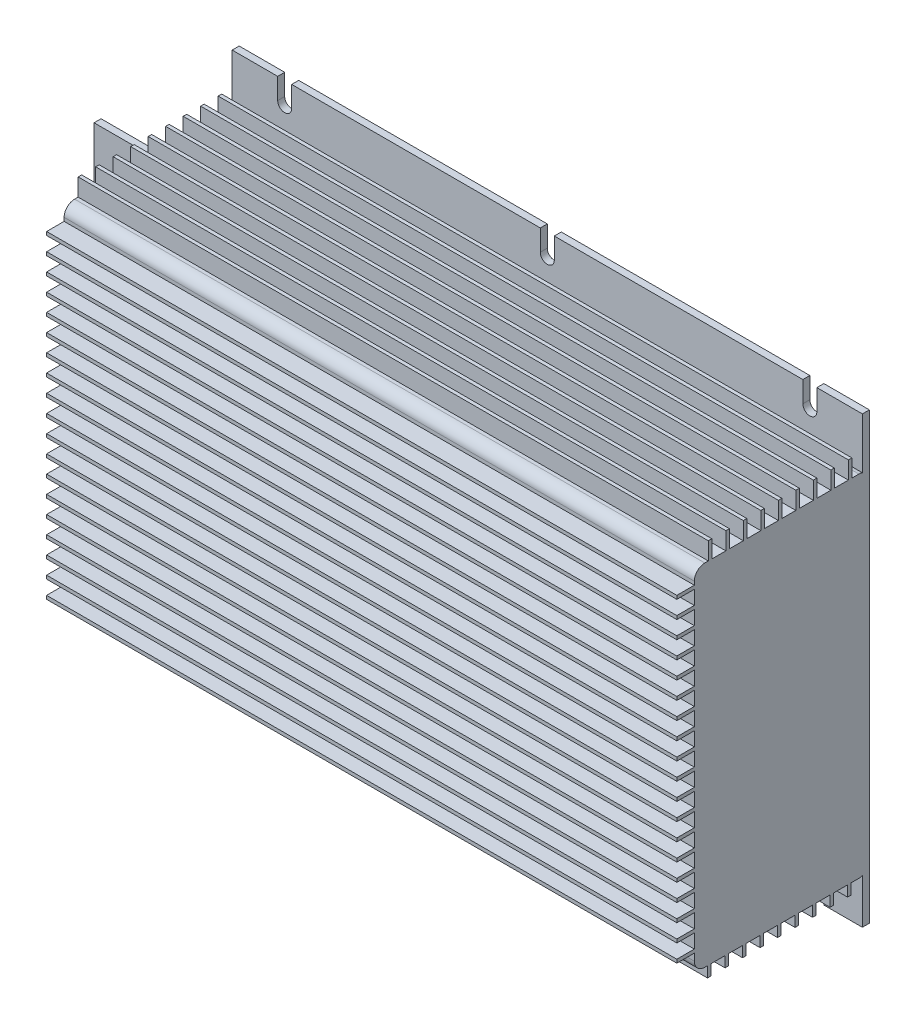
from build123d import *

# Parameters (mm, degrees)
SKETCH_1_W                       = 180
SKETCH_1_H                       = 100
EXTRUDE_1_DEPTH                  = 50
FILLET_1_R                       = 3
SKETCH_2_W                       = 180
SKETCH_2_H                       = 127
EXTRUDE_2_DEPTH                  = 2
SKETCH_3_W                       = 180
SKETCH_3_H                       = 1
EXTRUDE_3_DEPTH                  = 5
PATTERN_LINEAR_1_COUNT           = 19
PATTERN_LINEAR_1_PITCH           = 5
SKETCH_4_W                       = 180
SKETCH_4_H                       = 1
EXTRUDE_4_DEPTH                  = 5
PATTERN_LINEAR_2_COUNT           = 9
PATTERN_LINEAR_2_PITCH           = 5
PATTERN_LINEAR_2_COPY_1_SKETCH_W = 180
PATTERN_LINEAR_2_COPY_1_SKETCH_H = 1
PATTERN_LINEAR_2_COPY_1_DEPTH    = 5
PATTERN_LINEAR_2_COPY_2_SKETCH_W = 180
PATTERN_LINEAR_2_COPY_2_SKETCH_H = 1
PATTERN_LINEAR_2_COPY_2_DEPTH    = 5
PATTERN_LINEAR_2_COPY_3_SKETCH_W = 180
PATTERN_LINEAR_2_COPY_3_SKETCH_H = 1
PATTERN_LINEAR_2_COPY_3_DEPTH    = 5
PATTERN_LINEAR_2_COPY_4_SKETCH_W = 180
PATTERN_LINEAR_2_COPY_4_SKETCH_H = 1
PATTERN_LINEAR_2_COPY_4_DEPTH    = 5
PATTERN_LINEAR_2_COPY_5_SKETCH_W = 180
PATTERN_LINEAR_2_COPY_5_SKETCH_H = 1
PATTERN_LINEAR_2_COPY_5_DEPTH    = 5
PATTERN_LINEAR_2_COPY_6_SKETCH_W = 180
PATTERN_LINEAR_2_COPY_6_SKETCH_H = 1
PATTERN_LINEAR_2_COPY_6_DEPTH    = 5
PATTERN_LINEAR_2_COPY_7_SKETCH_W = 180
PATTERN_LINEAR_2_COPY_7_SKETCH_H = 1
PATTERN_LINEAR_2_COPY_7_DEPTH    = 5
PATTERN_LINEAR_2_COPY_8_SKETCH_W = 180
PATTERN_LINEAR_2_COPY_8_SKETCH_H = 1
PATTERN_LINEAR_2_COPY_8_DEPTH    = 5
CUT_EXTRUDE_1_DEPTH              = 10
PATTERN_LINEAR_3_COUNT           = 3
PATTERN_LINEAR_3_PITCH           = 75
SKETCH_7_W                       = 2
SKETCH_7_H                       = 18
EXTRUDE_5_DEPTH                  = 25


with BuildPart() as part:
    # 草图1 → 凸台-拉伸1 (new body)
    with BuildSketch(Plane.XY):
        with Locations((5.073068894, -6.221294363)):
            Rectangle(SKETCH_1_W, SKETCH_1_H)
    extrude(amount=EXTRUDE_1_DEPTH)

    # 圆角1
    fillet_1_edges = [part.edges().sort_by_distance(p)[0] for p in [
        (5.073068894, 43.778705637, 50),
        (5.073068894, 43.778705637, 0),
        (5.073068894, -56.221294363, 0),
        (5.073068894, -56.221294363, 50),
    ]]
    fillet(fillet_1_edges, radius=FILLET_1_R)

    # 草图2 → 凸台-拉伸2 (add)
    with BuildSketch(Plane(origin=(0, 0, 0), x_dir=(-1, 0, 0), z_dir=(0, 0, -1))):
        with Locations((-5.073068894, -5.340626106)):
            Rectangle(SKETCH_2_W, SKETCH_2_H)
    extrude(amount=-EXTRUDE_2_DEPTH)

    # 草图3 → 凸台-拉伸3 (add)
    with BuildSketch(Plane.XY.offset(50)):
        with Locations((5.073068894, 39.278705637)):
            Rectangle(SKETCH_3_W, SKETCH_3_H)
    extrude_3 = extrude(amount=EXTRUDE_3_DEPTH)

    # 阵列(线性)1: 凸台-拉伸3 ×19
    with Locations(*[(0, -i * PATTERN_LINEAR_1_PITCH, 0) for i in range(1, PATTERN_LINEAR_1_COUNT)]):
        add(extrude_3)

    # 草图4 → 凸台-拉伸4 (add)
    with BuildSketch(Plane(origin=(0, 43.778705637, 0), x_dir=(1, 0, 0), z_dir=(0, 1, 0))):
        with Locations((5.073068894, -45.5)):
            Rectangle(SKETCH_4_W, SKETCH_4_H)
    extrude_4 = extrude(amount=EXTRUDE_4_DEPTH)

    # 镜向1: 凸台-拉伸4 across plane
    add(extrude_4.mirror(Plane(origin=(0, -5.340600965, 0.011587331), x_dir=(0, 0.002169662941040486, 0.9999976462785911), z_dir=(0, -0.9999976462785912, 0.002169662941040486))))

    # 阵列(线性)2: 凸台-拉伸4 ×9
    with Locations(*[(0, 0, -i * PATTERN_LINEAR_2_PITCH) for i in range(1, PATTERN_LINEAR_2_COUNT)]):
        add(extrude_4)

    # 阵列(线性)2 copy 1 sketch → 阵列(线性)2 copy 1 (add)
    with BuildSketch(Plane(origin=(0, -54.459495396, -4.786855714), x_dir=(1, 0, 0), z_dir=(0, -0.9999905851254449, 0.0043393156685167435))):
        with Locations((5.073068894, 45.5)):
            Rectangle(PATTERN_LINEAR_2_COPY_1_SKETCH_W, PATTERN_LINEAR_2_COPY_1_SKETCH_H)
    extrude(amount=PATTERN_LINEAR_2_COPY_1_DEPTH)

    # 阵列(线性)2 copy 2 sketch → 阵列(线性)2 copy 2 (add)
    with BuildSketch(Plane(origin=(0, -54.459495396, -9.786855714), x_dir=(1, 0, 0), z_dir=(0, -0.9999905851254449, 0.0043393156685167435))):
        with Locations((5.073068894, 45.5)):
            Rectangle(PATTERN_LINEAR_2_COPY_2_SKETCH_W, PATTERN_LINEAR_2_COPY_2_SKETCH_H)
    extrude(amount=PATTERN_LINEAR_2_COPY_2_DEPTH)

    # 阵列(线性)2 copy 3 sketch → 阵列(线性)2 copy 3 (add)
    with BuildSketch(Plane(origin=(0, -54.459495396, -14.786855714), x_dir=(1, 0, 0), z_dir=(0, -0.9999905851254449, 0.0043393156685167435))):
        with Locations((5.073068894, 45.5)):
            Rectangle(PATTERN_LINEAR_2_COPY_3_SKETCH_W, PATTERN_LINEAR_2_COPY_3_SKETCH_H)
    extrude(amount=PATTERN_LINEAR_2_COPY_3_DEPTH)

    # 阵列(线性)2 copy 4 sketch → 阵列(线性)2 copy 4 (add)
    with BuildSketch(Plane(origin=(0, -54.459495396, -19.786855714), x_dir=(1, 0, 0), z_dir=(0, -0.9999905851254449, 0.0043393156685167435))):
        with Locations((5.073068894, 45.5)):
            Rectangle(PATTERN_LINEAR_2_COPY_4_SKETCH_W, PATTERN_LINEAR_2_COPY_4_SKETCH_H)
    extrude(amount=PATTERN_LINEAR_2_COPY_4_DEPTH)

    # 阵列(线性)2 copy 5 sketch → 阵列(线性)2 copy 5 (add)
    with BuildSketch(Plane(origin=(0, -54.459495396, -24.786855714), x_dir=(1, 0, 0), z_dir=(0, -0.9999905851254449, 0.0043393156685167435))):
        with Locations((5.073068894, 45.5)):
            Rectangle(PATTERN_LINEAR_2_COPY_5_SKETCH_W, PATTERN_LINEAR_2_COPY_5_SKETCH_H)
    extrude(amount=PATTERN_LINEAR_2_COPY_5_DEPTH)

    # 阵列(线性)2 copy 6 sketch → 阵列(线性)2 copy 6 (add)
    with BuildSketch(Plane(origin=(0, -54.459495396, -29.786855714), x_dir=(1, 0, 0), z_dir=(0, -0.9999905851254449, 0.0043393156685167435))):
        with Locations((5.073068894, 45.5)):
            Rectangle(PATTERN_LINEAR_2_COPY_6_SKETCH_W, PATTERN_LINEAR_2_COPY_6_SKETCH_H)
    extrude(amount=PATTERN_LINEAR_2_COPY_6_DEPTH)

    # 阵列(线性)2 copy 7 sketch → 阵列(线性)2 copy 7 (add)
    with BuildSketch(Plane(origin=(0, -54.459495396, -34.786855714), x_dir=(1, 0, 0), z_dir=(0, -0.9999905851254449, 0.0043393156685167435))):
        with Locations((5.073068894, 45.5)):
            Rectangle(PATTERN_LINEAR_2_COPY_7_SKETCH_W, PATTERN_LINEAR_2_COPY_7_SKETCH_H)
    extrude(amount=PATTERN_LINEAR_2_COPY_7_DEPTH)

    # 阵列(线性)2 copy 8 sketch → 阵列(线性)2 copy 8 (add)
    with BuildSketch(Plane(origin=(0, -54.459495396, -39.786855714), x_dir=(1, 0, 0), z_dir=(0, -0.9999905851254449, 0.0043393156685167435))):
        with Locations((5.073068894, 45.5)):
            Rectangle(PATTERN_LINEAR_2_COPY_8_SKETCH_W, PATTERN_LINEAR_2_COPY_8_SKETCH_H)
    extrude(amount=PATTERN_LINEAR_2_COPY_8_DEPTH)

    # 草图6 → 切除-拉伸1 (cut)
    with BuildSketch(Plane.XY.offset(2)):
        with BuildLine():
            Line((-69.926931106, -62.840626106), (-69.926931106, -68.840626106))
            Line((-69.926931106, -68.840626106), (-65.926931106, -68.840626106))
            Line((-65.926931106, -68.840626106), (-65.926931106, -62.840626106))
            ThreePointArc((-65.926931106, -62.840626106), (-67.926931106, -60.840626106), (-69.926931106, -62.840626106))
        make_face()
        with BuildLine():
            Line((-71.926931106, 52.159373894), (-71.926931106, 58.159373894))
            Line((-71.926931106, 58.159373894), (-67.926931106, 58.159373894))
            Line((-67.926931106, 58.159373894), (-67.926931106, 52.159373894))
            ThreePointArc((-67.926931106, 52.159373894), (-69.926931106, 50.159373894), (-71.926931106, 52.159373894))
        make_face()
    cut_extrude_1 = extrude(amount=-CUT_EXTRUDE_1_DEPTH, mode=Mode.SUBTRACT)

    # 阵列(线性)3: 切除-拉伸1 ×3
    with Locations(*[(i * PATTERN_LINEAR_3_PITCH, 0, 0) for i in range(1, PATTERN_LINEAR_3_COUNT)]):
        add(cut_extrude_1, mode=Mode.SUBTRACT)

    # 草图7 → 凸台-拉伸5 (add)
    with BuildSketch(Plane.ZY.offset(84.926931106)):
        with Locations((15.451817963, -4.100778418)):
            Rectangle(SKETCH_7_W, SKETCH_7_H)
        with Locations((15.451817963, 25.899221582)):
            Rectangle(SKETCH_7_W, SKETCH_7_H)
        with Locations((15.451817963, -34.100778418)):
            Rectangle(SKETCH_7_W, SKETCH_7_H)
    extrude(amount=EXTRUDE_5_DEPTH)


solid = part.part
